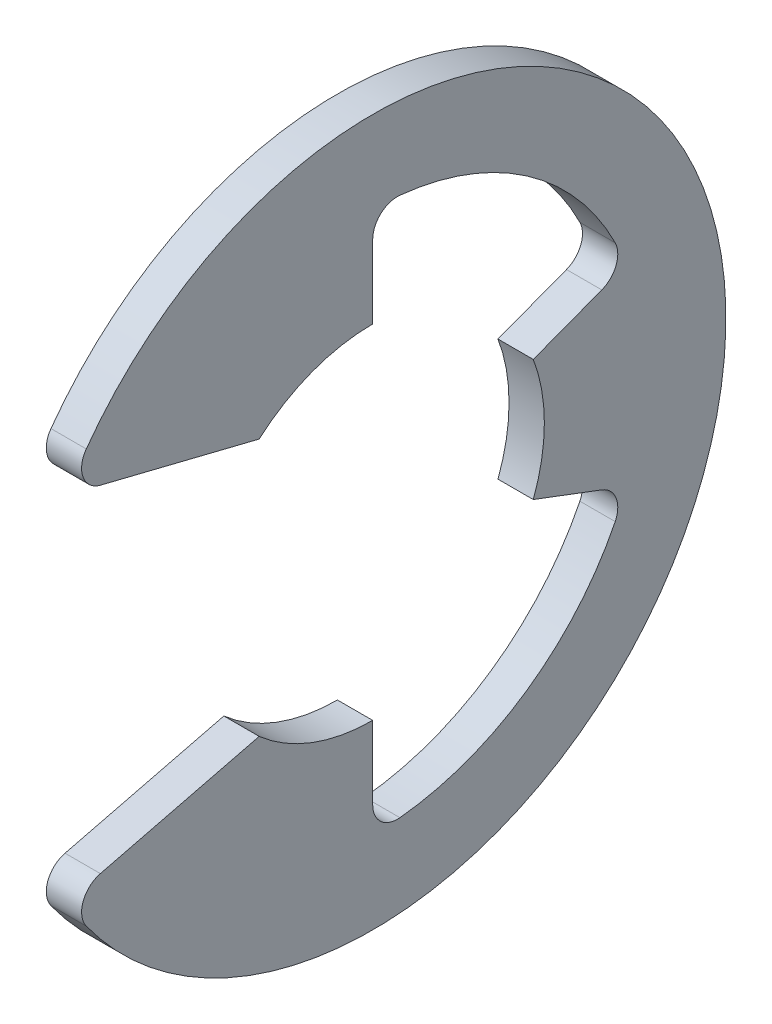
from build123d import *

# Parameters (mm, degrees)
EXTRUDE1_DEPTH = 0.3175
FILLET1_R      = 0.4445


with BuildPart() as part:
    # Sketch1 → Extrude1 (new, symmetric)
    with BuildSketch(Plane(origin=(0, 0, 0), x_dir=(0, 0, -1), z_dir=(1, 0, 0))):
        with BuildLine():
            Line((-5.500228654, -3.173323929), (-2.04126328, -2.314575))
            ThreePointArc((-2.04126328, -2.314575), (-1.091101119, -2.886782215), (0, -3.0861))
            Line((0, -3.0861), (0, -4.870245161))
            ThreePointArc((0, -4.870245161), (2.768867391, -4.006577255), (4.555697196, -1.72189169))
            Line((4.555697196, -1.72189169), (2.886782215, -1.091101119))
            ThreePointArc((2.886782215, -1.091101119), (3.0861, 0), (2.886782215, 1.091101119))
            Line((2.886782215, 1.091101119), (4.555697196, 1.72189169))
            ThreePointArc((4.555697196, 1.72189169), (2.768867391, 4.006577255), (0, 4.870245161))
            Line((0, 4.870245161), (0, 3.0861))
            ThreePointArc((0, 3.0861), (-1.091101119, 2.886782215), (-2.04126328, 2.314575))
            Line((-2.04126328, 2.314575), (-5.500228654, 3.173323929))
            ThreePointArc((-5.500228654, 3.173323929), (6.35, 0), (-5.500228654, -3.173323929))
        make_face()
    extrude(amount=EXTRUDE1_DEPTH, both=True)

    # Fillet1
    fillet1_edges = [part.edges().sort_by_distance(p)[0] for p in [
        (0, -3.173323929, 5.500228654),
        (0, -4.870245161, 0),
        (0, -1.72189169, -4.555697196),
        (0, 1.72189169, -4.555697196),
        (0, 4.870245161, 0),
        (0, 3.173323929, 5.500228654),
    ]]
    fillet(fillet1_edges, radius=FILLET1_R)


solid = part.part
